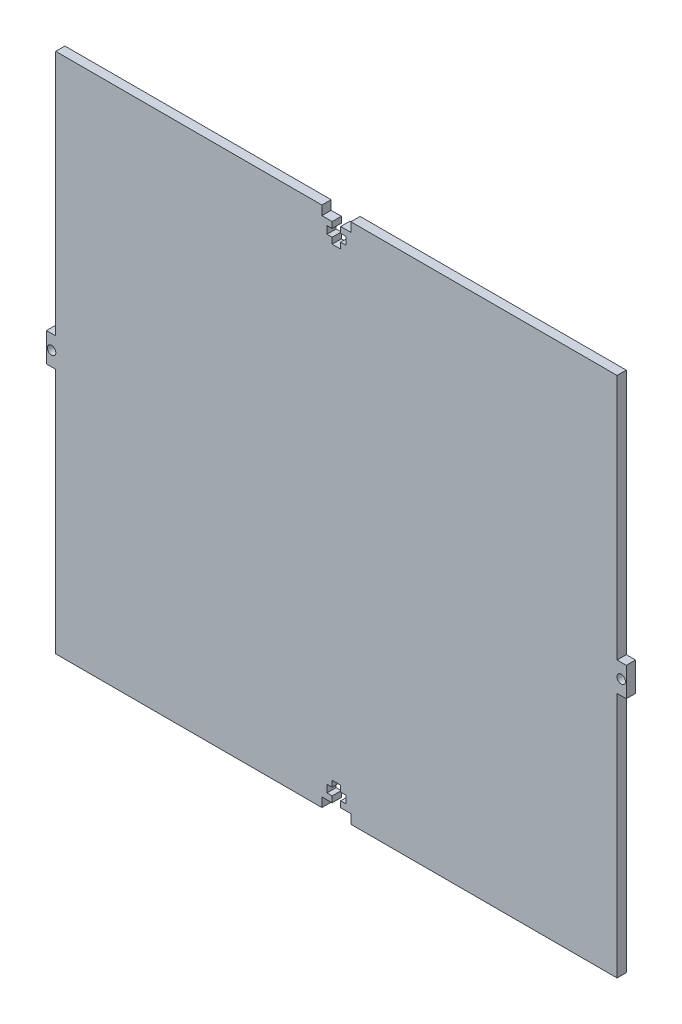
from build123d import *

# Parameters (mm, degrees)
SKETCH2_W           = 193.64
SKETCH2_H           = 180
BOSS_EXTRUDE1_DEPTH = 3.18
CUT_EXTRUDE1_DEPTH  = 133.227927459
SKETCH4_W           = 3.18
SKETCH4_H           = 10
BOSS_EXTRUDE2_DEPTH = 3.18
SKETCH6_R           = 1.47
CUT_EXTRUDE2_DEPTH  = 135.573817662


with BuildPart() as part:
    # Sketch2 → Boss-Extrude1 (new body)
    with BuildSketch(Plane.XY):
        Rectangle(SKETCH2_W, SKETCH2_H)
    extrude(amount=BOSS_EXTRUDE1_DEPTH)

    # Sketch3 → Cut-Extrude1 (cut, through all)
    with BuildSketch(Plane.XY.offset(3.18)):
        Polygon((-5, 90), (5, 90), (5, 86.82), (1.47, 86.82), (1.47, 84.74), (3.25, 84.74), (3.25, 82.14), (1.47, 82.14), (1.47, 80.07), (-1.47, 80.07), (-1.47, 82.14), (-3.25, 82.14), (-3.25, 84.74), (-1.47, 84.74), (-1.47, 86.82), (-5, 86.82), align=None)
        Polygon((1.47, -86.82), (5, -86.82), (5, -90), (-5, -90), (-5, -86.82), (-1.47, -86.82), (-1.47, -84.74), (-3.25, -84.74), (-3.25, -82.14), (-1.47, -82.14), (-1.47, -80.07), (1.47, -80.07), (1.47, -82.14), (3.25, -82.14), (3.25, -84.74), (1.47, -84.74), align=None)
    extrude(amount=-CUT_EXTRUDE1_DEPTH, mode=Mode.SUBTRACT)

    # Sketch4 → Boss-Extrude2 (add)
    with BuildSketch(Plane.ZY.offset(96.82)):
        with Locations((1.59, 0)):
            Rectangle(SKETCH4_W, SKETCH4_H)
    boss_extrude2 = extrude(amount=BOSS_EXTRUDE2_DEPTH)

    # Sketch6 → Cut-Extrude2 (cut, through all)
    with BuildSketch(Plane.XY.offset(3.18)):
        with Locations((-98.25, 0)):
            Circle(SKETCH6_R)
    cut_extrude2 = extrude(amount=-CUT_EXTRUDE2_DEPTH, mode=Mode.SUBTRACT)

    # Mirror1: Boss-Extrude2 across plane
    add(boss_extrude2.mirror(Plane(origin=(0, 0, 0), x_dir=(0, 0, 1), z_dir=(1, 0, 0))))

    # Mirror2: Cut-Extrude2 across plane
    add(cut_extrude2.mirror(Plane(origin=(0, 0, 0), x_dir=(0, 0, 1), z_dir=(1, 0, 0))), mode=Mode.SUBTRACT)


solid = part.part
